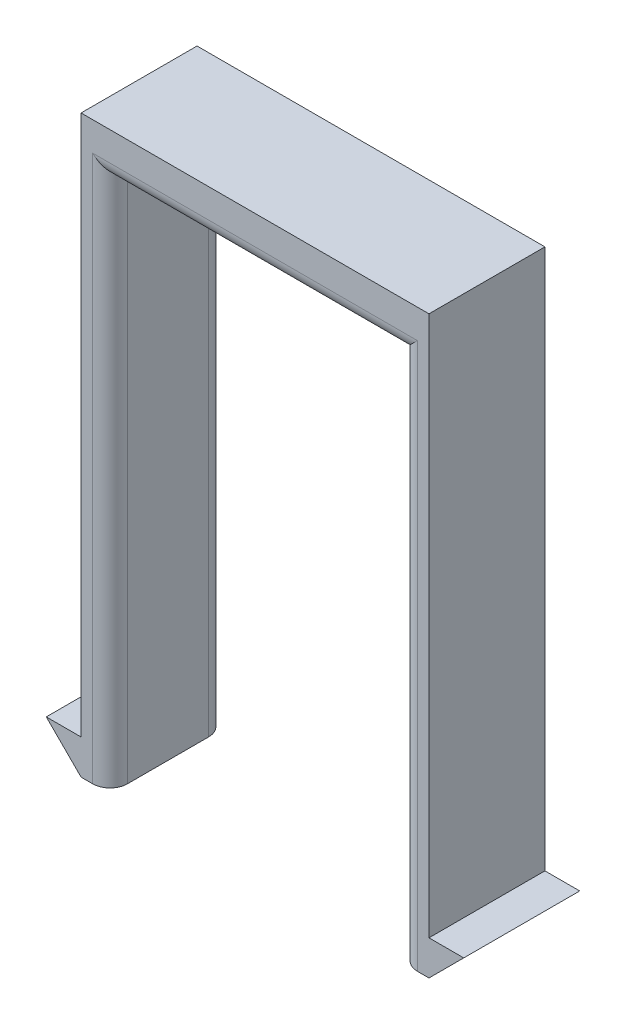
from build123d import *

# Parameters (mm, degrees)
BOSS_EXTRUDE1_DEPTH = 10
BOSS_EXTRUDE3_DEPTH = 10
FILLET3_R           = 1.5


with BuildPart() as part:
    # Sketch1 → Boss-Extrude1 (new body)
    with BuildSketch(Plane.XY):
        Polygon((-12.5, -2), (12.5, -2), (12.5, -47.6), (15, -47.6), (15, -2), (15, 2), (-15, 2), (-15, -2), (-15, -47.6), (-12.5, -47.6), align=None)
    extrude(amount=BOSS_EXTRUDE1_DEPTH)

    # Sketch2 → Boss-Extrude3 (add)
    with BuildSketch(Plane.XY.offset(10)):
        Polygon((18, -44.6), (15, -47.6), (15, -44.6), align=None)
        Polygon((-15, -47.6), (-15, -44.6), (-18, -44.6), align=None)
    extrude(amount=-BOSS_EXTRUDE3_DEPTH)

    # Fillet3
    fillet3_edges = [part.edges().sort_by_distance(p)[0] for p in [
        (12.5, -24.8, 0),
        (0, -2, 0),
        (-12.5, -24.8, 0),
        (-12.5, -24.8, 10),
        (0, -2, 10),
        (12.5, -24.8, 10),
    ]]
    fillet(fillet3_edges, radius=FILLET3_R)


solid = part.part
